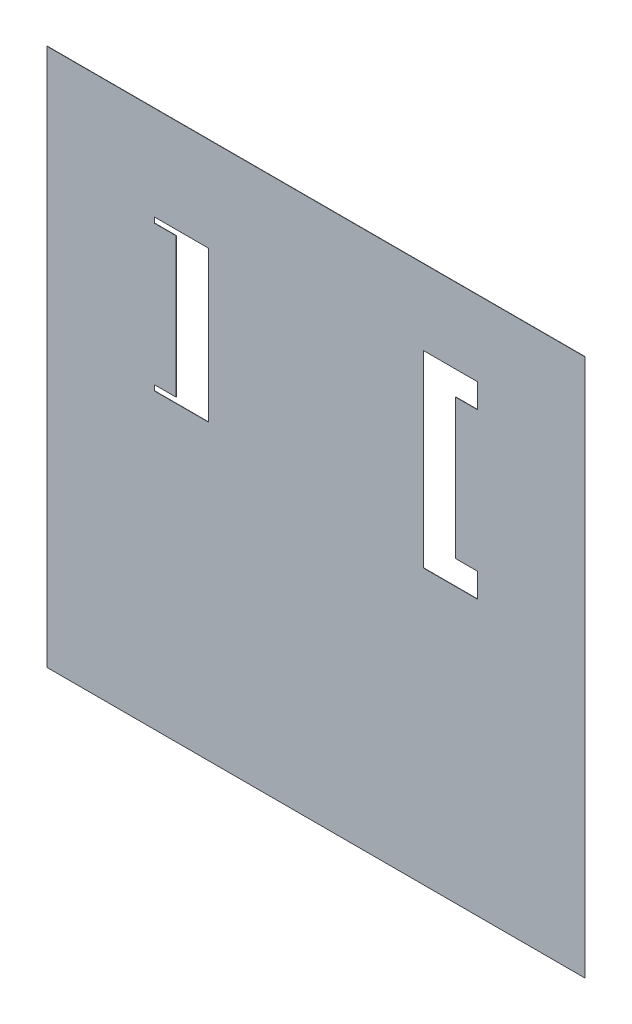
from build123d import *

# Parameters (mm, degrees)
SKETCH1_W               = 25.4
SKETCH1_H               = 25.4
BOSS_EXTRUDE1_DEPTH     = 0.0127
CUT_EXTRUDE8_DEPTH      = 3.556
CUT_EXTRUDE8_DEPTH_BACK = 36.921026729


with BuildPart() as part:
    # Sketch1 → Boss-Extrude1 (new body)
    with BuildSketch(Plane.XY):
        with Locations((12.7, 12.7)):
            Rectangle(SKETCH1_W, SKETCH1_H)
    extrude(amount=BOSS_EXTRUDE1_DEPTH)

    # Sketch2 → Cut-Extrude8 (cut, two sides: drawn at the far end of the back side and taken through both)
    with BuildSketch(Plane.XY.offset(0.0127).offset(-CUT_EXTRUDE8_DEPTH_BACK)):
        Polygon((5.08, 20.955), (7.62, 20.955), (7.62, 13.843), (5.08, 13.843), (5.08, 14.097), (6.096, 14.097), (6.096, 20.701), (5.08, 20.701), align=None)
        Polygon((17.78, 21.844), (20.32, 21.844), (20.32, 20.701), (19.304, 20.701), (19.304, 14.097), (20.32, 14.097), (20.32, 12.954), (17.78, 12.954), align=None)
    extrude(amount=CUT_EXTRUDE8_DEPTH + CUT_EXTRUDE8_DEPTH_BACK, mode=Mode.SUBTRACT)


solid = part.part
